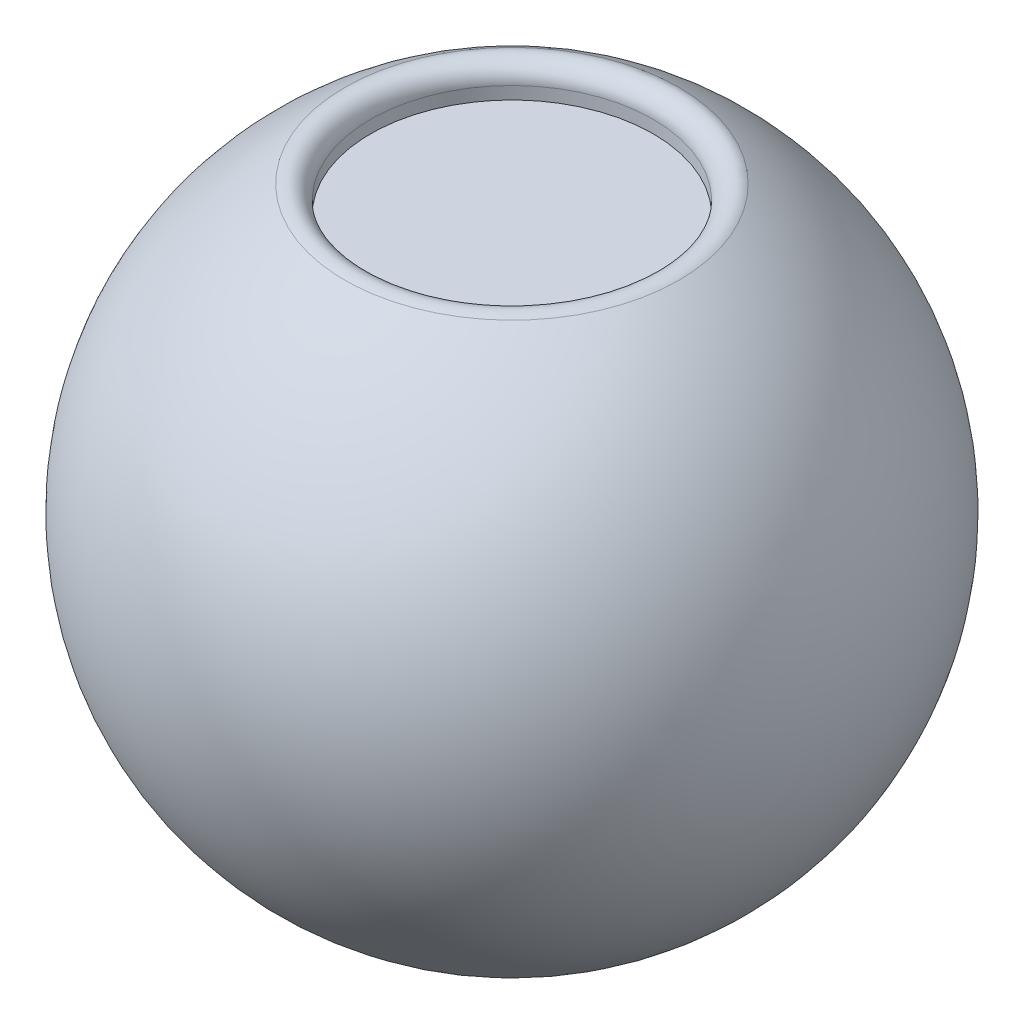
from build123d import *

# Parameters (mm, degrees)
KES_EKSTR_ZYON1_DEPTH      = 95.305355097
KES_EKSTR_ZYON1_DEPTH_BACK = 95.305355097
IZIM3_W                    = 6.7
IZIM3_H                    = 83.072589547
KES_EKSTR_ZYON2_START      = 30
IZIM4_R                    = 16.5
KES_EKSTR_ZYON2_DEPTH      = 65.305355097
RADYUS1_R                  = 2


with BuildPart() as part:
    # Çizim2 → Döndür1 (revolve)
    with BuildSketch(Plane.XY):
        with BuildLine():
            Line((77, 0), (0, 0))
            ThreePointArc((0, 0), (38.5, 38.5), (77, 0))
        make_face()
    revolve(axis=Axis((77, 0, 0), (-1, 0, 0)))

    # Çizim3 → Kes-Ekstrüzyon1 (cut, two sides: drawn at the far end of the back side and taken through both)
    with BuildSketch(Plane(origin=(0, 0, 0), x_dir=(1, 0, 0), z_dir=(0, 1, 0)).offset(-KES_EKSTR_ZYON1_DEPTH_BACK)):
        with Locations((3.35, -0.927609561)):
            Rectangle(IZIM3_W, IZIM3_H)
    extrude(amount=KES_EKSTR_ZYON1_DEPTH + KES_EKSTR_ZYON1_DEPTH_BACK, mode=Mode.SUBTRACT)

    # Çizim4 → Kes-Ekstrüzyon2 (cut, through all)
    with BuildSketch(Plane(origin=(0, 0, 0), x_dir=(1, 0, 0), z_dir=(0, 1, 0)).offset(KES_EKSTR_ZYON2_START)):
        with Locations(Location((38.5, 0, 0), (0, 0, 90))):
            Circle(IZIM4_R)
    extrude(amount=KES_EKSTR_ZYON2_DEPTH, mode=Mode.SUBTRACT)

    # Radyus1
    radyus1_edges = [part.edges().sort_by_distance(p)[0] for p in [
        (26.832738111, 34.785054262, -11.667261889),
    ]]
    fillet(radyus1_edges, radius=RADYUS1_R)


solid = part.part
